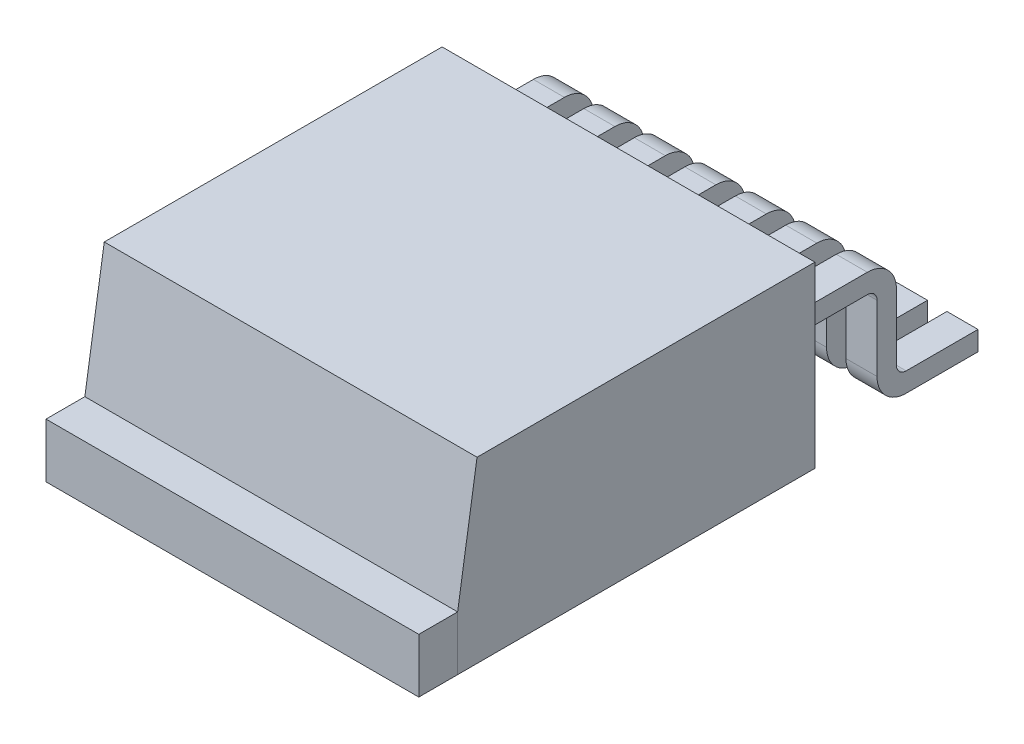
from build123d import *

# Parameters (mm, degrees)
BOSS_EXTRUDE1_DEPTH = 4.8
SKETCH2_W           = 9.6
SKETCH2_H           = 1.4
BOSS_EXTRUDE2_DEPTH = 1
SKETCH3_W           = 0.8
SKETCH3_H           = 0.5
BOSS_EXTRUDE3_DEPTH = 2.6
SKETCH4_W           = 0.8
SKETCH4_H           = 0.5
BOSS_EXTRUDE4_DEPTH = 3.2
SKETCH5_W           = 0.8
SKETCH5_H           = 0.5
BOSS_EXTRUDE5_DEPTH = 2.6
FILLET1_R           = 0.75
FILLET2_R           = 0.25
LPATTERN3_COUNT     = 7
LPATTERN3_PITCH     = 1.3


with BuildPart() as part:
    # Sketch1 → Boss-Extrude1 (new, symmetric)
    with BuildSketch(Plane(origin=(0, 0, 0), x_dir=(0, 0, -1), z_dir=(1, 0, 0))):
        Polygon((4.6, 0), (4.6, 4.6), (-4.1, 4.6), (-4.6, 1.4), (-4.6, 0), align=None)
    extrude(amount=BOSS_EXTRUDE1_DEPTH, both=True)


with BuildPart() as body_2:
    # Sketch2 → Boss-Extrude2 (new body)
    with BuildSketch(Plane.XY.offset(4.6)):
        with Locations((0, 0.7)):
            Rectangle(SKETCH2_W, SKETCH2_H)
    extrude(amount=BOSS_EXTRUDE2_DEPTH)


with BuildPart() as body_3:
    # Sketch3 → Boss-Extrude3 (new body)
    with BuildSketch(Plane(origin=(0, 0, -4.6), x_dir=(-1, 0, 0), z_dir=(0, 0, -1))):
        with Locations((-3.9, 2.95)):
            Rectangle(SKETCH3_W, SKETCH3_H)
    extrude(amount=BOSS_EXTRUDE3_DEPTH)

    # Sketch4 → Boss-Extrude4 (add)
    with BuildSketch(Plane(origin=(0, 3.2, 0), x_dir=(1, 0, 0), z_dir=(0, 1, 0))):
        with Locations((3.9, 6.95)):
            Rectangle(SKETCH4_W, SKETCH4_H)
    extrude(amount=-BOSS_EXTRUDE4_DEPTH)

    # Sketch5 → Boss-Extrude5 (add)
    with BuildSketch(Plane.XY.offset(-6.7)):
        with Locations((3.9, 0.25)):
            Rectangle(SKETCH5_W, SKETCH5_H)
    extrude(amount=-BOSS_EXTRUDE5_DEPTH)

    # Fillet1
    fillet1_edges = [body_3.edges().sort_by_distance(p)[0] for p in [
        (3.9, 3.2, -7.2),
        (3.9, 0, -6.7),
    ]]
    fillet(fillet1_edges, radius=FILLET1_R)

    # Fillet2
    fillet2_edges = [body_3.edges().sort_by_distance(p)[0] for p in [
        (3.9, 2.7, -6.7),
        (3.9, 0.5, -7.2),
    ]]
    fillet(fillet2_edges, radius=FILLET2_R)


with BuildPart() as lpattern3_1:
    # LPattern3: pattern copy
    add(body_3.part.moved(Location(Vector(-1, 0, 0) * (1 * LPATTERN3_PITCH))))


with BuildPart() as lpattern3_2:
    # LPattern3: pattern copy
    add(body_3.part.moved(Location(Vector(-1, 0, 0) * (2 * LPATTERN3_PITCH))))


with BuildPart() as lpattern3_3:
    # LPattern3: pattern copy
    add(body_3.part.moved(Location(Vector(-1, 0, 0) * (3 * LPATTERN3_PITCH))))


with BuildPart() as lpattern3_4:
    # LPattern3: pattern copy
    add(body_3.part.moved(Location(Vector(-1, 0, 0) * (4 * LPATTERN3_PITCH))))


with BuildPart() as lpattern3_5:
    # LPattern3: pattern copy
    add(body_3.part.moved(Location(Vector(-1, 0, 0) * (5 * LPATTERN3_PITCH))))


with BuildPart() as lpattern3_6:
    # LPattern3: pattern copy
    add(body_3.part.moved(Location(Vector(-1, 0, 0) * (6 * LPATTERN3_PITCH))))


solid = Compound([part.part, body_2.part, body_3.part, lpattern3_1.part, lpattern3_2.part, lpattern3_3.part, lpattern3_4.part, lpattern3_5.part, lpattern3_6.part])
